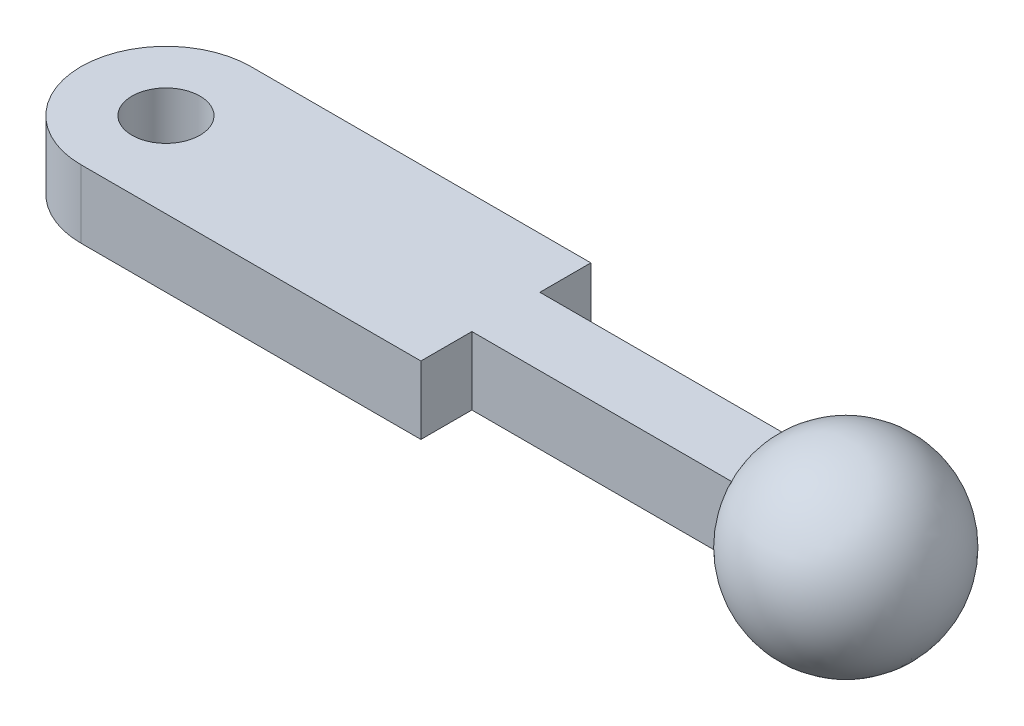
from build123d import *

# Parameters (mm, degrees)
SKETCH1_R               = 1
BOSS_EXTRUDE1_DEPTH     = 2
SKETCH4_W               = 2
SKETCH4_H               = 2
BOSS_EXTRUDE2_DEPTH     = 11
CUT_EXTRUDE1_DEPTH      = 13.903487901
CUT_EXTRUDE1_DEPTH_BACK = 13.903487901
CUT_EXTRUDE2_DEPTH      = 14.133925537
CUT_EXTRUDE2_DEPTH_BACK = 14.133925537
CUT_EXTRUDE3_DEPTH      = 14.133925537
CUT_EXTRUDE3_DEPTH_BACK = 14.133925537
SKETCH7_R               = 0.5


with BuildPart() as part:
    # Sketch1 → Boss-Extrude1 (new body)
    with BuildSketch(Plane(origin=(0, 0, 0), x_dir=(1, 0, 0), z_dir=(0, 1, 0))):
        with BuildLine():
            Line((-10, 2.5), (0, 2.5))
            Line((0, 2.5), (0, -2.5))
            Line((0, -2.5), (-10, -2.5))
            ThreePointArc((-10, -2.5), (-12.5, 0), (-10, 2.5))
        make_face()
        with Locations(Location((-10, 0, 0), (0, 0, 270))):
            Circle(SKETCH1_R, mode=Mode.SUBTRACT)
    extrude(amount=BOSS_EXTRUDE1_DEPTH)

    # Sketch4 → Boss-Extrude2 (add)
    with BuildSketch(Plane(origin=(0, 0, 0), x_dir=(0, 0, -1), z_dir=(1, 0, 0))):
        with Locations((0, 1)):
            Rectangle(SKETCH4_W, SKETCH4_H)
    extrude(amount=BOSS_EXTRUDE2_DEPTH)

    # Sketch5 → Cut-Extrude1 (cut, two sides: drawn at the far end of the back side and taken through both)
    with BuildSketch(Plane(origin=(0, 2, 0), x_dir=(1, 0, 0), z_dir=(0, 1, 0)).offset(-CUT_EXTRUDE1_DEPTH_BACK)):
        with BuildLine():
            Line((10, 1), (10, 1.5))
            Line((10, 1.5), (12, 1.5))
            Line((12, 1.5), (12, -1.5))
            Line((12, -1.5), (10, -1.5))
            Line((10, -1.5), (10, -1))
            ThreePointArc((10, -1), (11, 0), (10, 1))
        make_face()
    extrude(amount=CUT_EXTRUDE1_DEPTH + CUT_EXTRUDE1_DEPTH_BACK, mode=Mode.SUBTRACT)

    # Sketch6 → Cut-Extrude2 (cut, two sides: drawn at the far end of the back side and taken through both)
    with BuildSketch(Plane(origin=(0, 0, -1), x_dir=(-1, 0, 0), z_dir=(0, 0, -1)).offset(-CUT_EXTRUDE2_DEPTH_BACK)):
        with BuildLine():
            Line((-10, 2), (-10, 2.5))
            Line((-10, 2.5), (-12, 2.5))
            Line((-12, 2.5), (-12, -0.5))
            Line((-12, -0.5), (-10, -0.5))
            Line((-10, -0.5), (-10, 0))
            ThreePointArc((-10, 0), (-11, 1), (-10, 2))
        make_face()
    extrude(amount=CUT_EXTRUDE2_DEPTH + CUT_EXTRUDE2_DEPTH_BACK, mode=Mode.SUBTRACT)

    # Sketch7 → Cut-Extrude3 (cut, two sides: drawn at the far end of the back side and taken through both)
    with BuildSketch(Plane(origin=(0, 0, -1), x_dir=(-1, 0, 0), z_dir=(0, 0, -1)).offset(-CUT_EXTRUDE3_DEPTH_BACK)):
        with Locations(Location((-10, 1, 0), (0, 0, 90))):
            Circle(SKETCH7_R)
    extrude(amount=CUT_EXTRUDE3_DEPTH + CUT_EXTRUDE3_DEPTH_BACK, mode=Mode.SUBTRACT)

    # Sketch10 → Revolve1 (revolve)
    with BuildSketch(Plane.XY):
        with BuildLine():
            ThreePointArc((10, 3.75), (12.75, 1), (10, -1.75))
            Line((10, -1.75), (10, 1))
            Line((10, 1), (10, 3.75))
        make_face()
    revolve(axis=Axis((10, 1, 0), (0, 1, 0)))


solid = part.part
